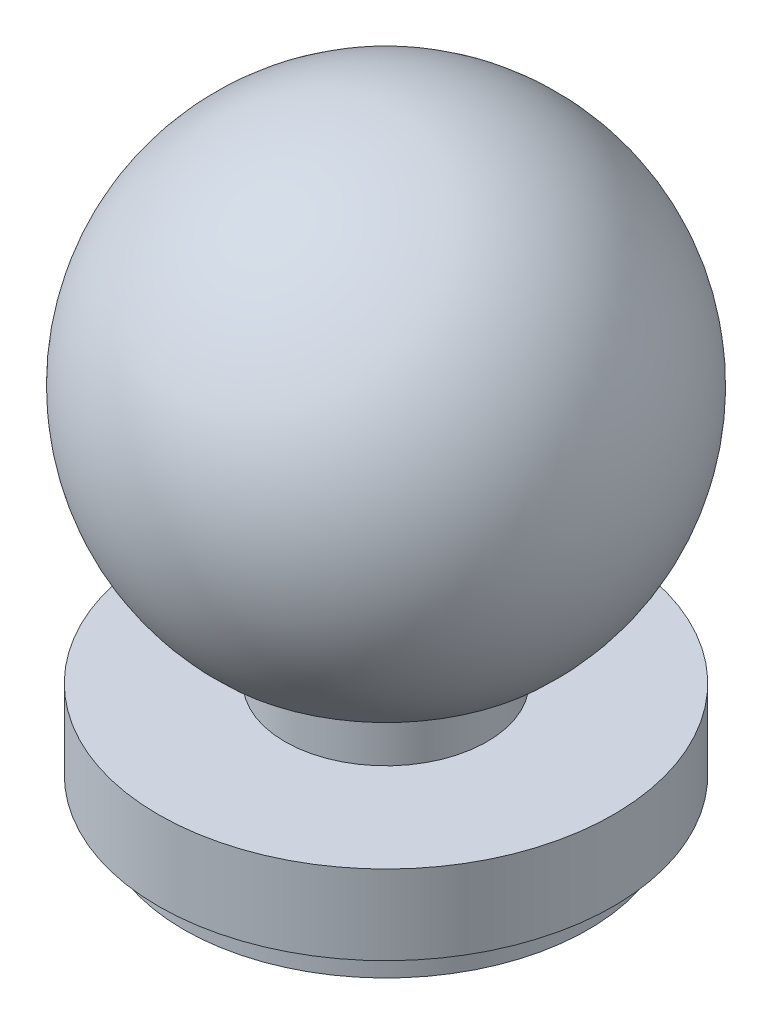
from build123d import *

# Parameters (mm, degrees)
SKETCH1_R           = 4.5
BOSS_EXTRUDE1_DEPTH = 1.57
SKETCH2_R           = 2
BOSS_EXTRUDE2_DEPTH = 5.1
SKETCH5_W           = 1.2
SKETCH5_H           = 0.798080121
SKETCH4_R           = 4
BOSS_EXTRUDE3_DEPTH = 0.65


with BuildPart() as part:
    # Sketch1 → Boss-Extrude1 (new body)
    with BuildSketch(Plane(origin=(0, 0, 0), x_dir=(1, 0, 0), z_dir=(0, 1, 0))):
        with Locations(Location((0, 0, 0), (0, 0, 270))):
            Circle(SKETCH1_R)
    extrude(amount=BOSS_EXTRUDE1_DEPTH)

    # Sketch2 → Boss-Extrude2 (add)
    with BuildSketch(Plane(origin=(0, 1.57, 0), x_dir=(1, 0, 0), z_dir=(0, 1, 0))):
        with Locations(Location((0, 0, 0), (0, 0, 270))):
            Circle(SKETCH2_R)
    extrude(amount=BOSS_EXTRUDE2_DEPTH)

    # Sketch3 → Revolve1 (revolve)
    with BuildSketch(Plane(origin=(0, 6.67, 0), x_dir=(1, 0, 0), z_dir=(0, 1, 0))):
        with BuildLine():
            Line((0, 4.75), (0, -4.75))
            ThreePointArc((0, -4.75), (4.75, 0), (0, 4.75))
        make_face()
    revolve(axis=Axis((0, 6.67, -8.311953328), (0, 0, 1)))

    # Sketch5 → Cut-Revolve1 (revolve, cut)
    with BuildSketch(Plane.XY, mode=Mode.PRIVATE) as cut_revolve1_sk:
        with Locations((2.6, 2.760618076)):
            Rectangle(SKETCH5_W, SKETCH5_H)
    revolve(cut_revolve1_sk.sketch.rotate(Axis((0, 3.159658136, 0), (0, -1, 0)), 90), axis=Axis((0, 3.159658136, 0), (0, -1, 0)), mode=Mode.SUBTRACT)

    # Sketch4 → Boss-Extrude3 (add)
    with BuildSketch(Plane.XZ):
        with Locations(Location((0, 0, 0), (0, 0, 270))):
            Circle(SKETCH4_R)
    extrude(amount=BOSS_EXTRUDE3_DEPTH)


solid = part.part
